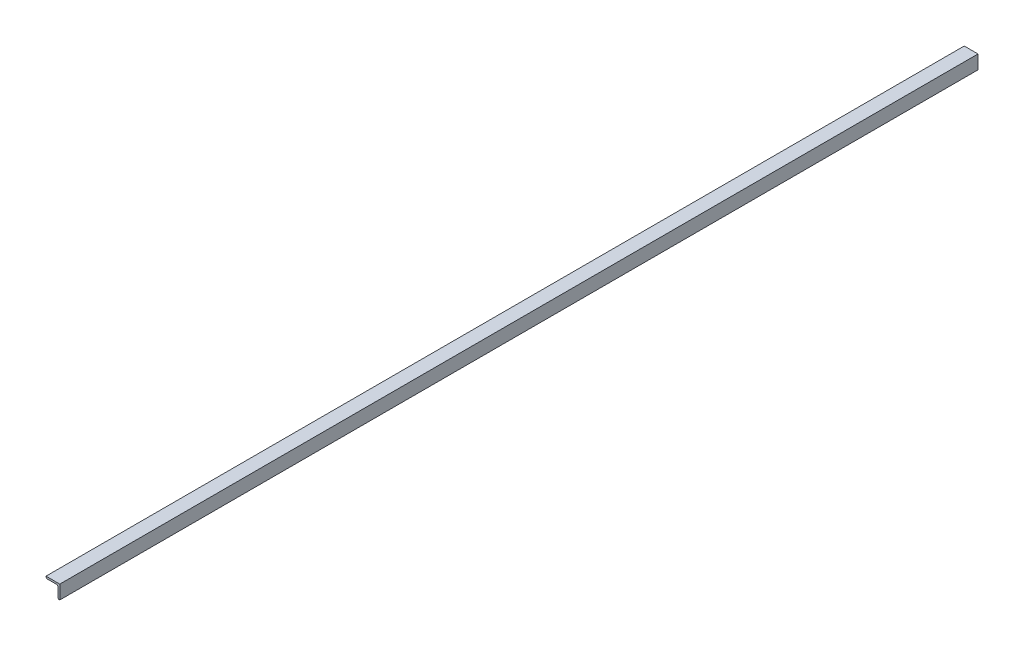
from build123d import *

# Parameters (mm, degrees)
BOSS_EXTRUDE1_DEPTH = 2000


with BuildPart() as part:
    # Sketch1 → Boss-Extrude1 (new body)
    with BuildSketch(Plane.XY):
        with BuildLine():
            Line((-39.698623859, 15.861868179), (-9.698623859, 15.861868179))
            Line((-9.698623859, 15.861868179), (-9.698623859, -14.138131821))
            Line((-9.698623859, -14.138131821), (-10.698623859, -14.138131821))
            ThreePointArc((-10.698623859, -14.138131821), (-12.819944203, -13.259452165), (-13.698623859, -11.138131821))
            Line((-13.698623859, -11.138131821), (-13.698623859, 8.861868179))
            ThreePointArc((-13.698623859, 8.861868179), (-14.577303516, 10.983188522), (-16.698623859, 11.861868179))
            Line((-16.698623859, 11.861868179), (-36.698623859, 11.861868179))
            ThreePointArc((-36.698623859, 11.861868179), (-38.819944203, 12.740547835), (-39.698623859, 14.861868179))
            Line((-39.698623859, 14.861868179), (-39.698623859, 15.861868179))
        make_face()
    extrude(amount=BOSS_EXTRUDE1_DEPTH)


solid = part.part
